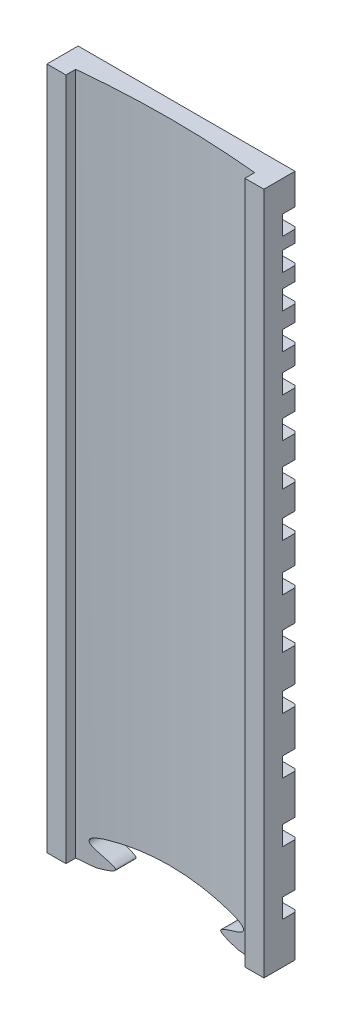
from build123d import *

# Parameters (mm, degrees)
SKETCH2_W               = 73.126
SKETCH2_H               = 465.703533893
BOSS_EXTRUDE1_DEPTH     = 12.8
CUT_EXTRUDE3_DEPTH      = 468.311966945
CUT_EXTRUDE3_DEPTH_BACK = 468.311966945
SKETCH4_W               = 73.126
SKETCH4_H               = 6.4
BOSS_EXTRUDE3_DEPTH     = 12.8
CHAMFER5_SIZE           = 0.7
SKETCH1_W               = 80.142296905
SKETCH1_H               = 6.5
CUT_EXTRUDE4_DEPTH      = 5
SKETCH7_W               = 73.126
SKETCH7_H               = 472.103533893
CUT_EXTRUDE7_DEPTH      = 1.6
CUT_EXTRUDE8_DEPTH      = 10
CUT_EXTRUDE8_DEPTH_BACK = 10
SKETCH6_OUTSIDE_W       = 170.698
SKETCH6_OUTSIDE_H       = 569.676


with BuildPart() as part:
    # Sketch2 → Boss-Extrude1 (new body)
    with BuildSketch(Plane.XY):
        with Locations((0, 232.851766947)):
            Rectangle(SKETCH2_W, SKETCH2_H)
    extrude(amount=BOSS_EXTRUDE1_DEPTH)

    # Sketch3 → Cut-Extrude3 (cut, two sides: drawn at the far end of the back side and taken through both)
    with BuildSketch(Plane(origin=(0, 0, 0), x_dir=(1, 0, 0), z_dir=(0, 1, 0)).offset(-CUT_EXTRUDE3_DEPTH_BACK)):
        with BuildLine():
            Line((30.163, -158.685232104), (30.163, -12.8))
            Line((30.163, -12.8), (30.163, -7.896136802))
            ThreePointArc((30.163, -7.896136802), (0, -6.4), (-30.163, -7.896136802))
            Line((-30.163, -7.896136802), (-30.163, -12.8))
            Line((-30.163, -12.8), (-30.163, -158.685232104))
            Line((-30.163, -158.685232104), (-30.163, -450.455696312))
            Line((-30.163, -450.455696312), (30.163, -450.455696312))
            Line((30.163, -450.455696312), (30.163, -158.685232104))
        make_face()
    extrude(amount=CUT_EXTRUDE3_DEPTH + CUT_EXTRUDE3_DEPTH_BACK, mode=Mode.SUBTRACT)

    # Sketch4 → Boss-Extrude3 (add)
    with BuildSketch(Plane.XY):
        with Locations((0, -3.2)):
            Rectangle(SKETCH4_W, SKETCH4_H)
    extrude(amount=BOSS_EXTRUDE3_DEPTH)

    # Chamfer5
    chamfer5_edges = [part.edges().sort_by_distance(p)[0] for p in [
        (0, -6.4, 0),
        (0, 465.703533893, 0),
        (36.563, 229.651766947, 0),
        (-36.563, 229.651766947, 0),
    ]]
    chamfer(chamfer5_edges, length=CHAMFER5_SIZE)

    # Sketch1 → Cut-Extrude4 (cut)
    with BuildSketch(Plane.XY):
        with Locations((0.607494054, 452.05915)):
            Rectangle(SKETCH1_W, SKETCH1_H)
        with Locations((0.607494054, 441.46337)):
            Rectangle(SKETCH1_W, SKETCH1_H)
        with Locations((0.607494054, 64.52931)):
            Rectangle(SKETCH1_W, SKETCH1_H)
        with Locations((0.607494054, 96.28078)):
            Rectangle(SKETCH1_W, SKETCH1_H)
        with Locations((0.607494054, 363.26539)):
            Rectangle(SKETCH1_W, SKETCH1_H)
        with Locations((0.607494054, 154.5375)):
            Rectangle(SKETCH1_W, SKETCH1_H)
        with Locations((0.607494054, 206.43835)):
            Rectangle(SKETCH1_W, SKETCH1_H)
        with Locations((0.607494054, 252.67674)):
            Rectangle(SKETCH1_W, SKETCH1_H)
        with Locations((0.607494054, 293.87047)):
            Rectangle(SKETCH1_W, SKETCH1_H)
        with Locations((0.607494054, 330.56991)):
            Rectangle(SKETCH1_W, SKETCH1_H)
        with Locations((0.607494054, 378.25008)):
            Rectangle(SKETCH1_W, SKETCH1_H)
        with Locations((0.607494054, 405.7436)):
            Rectangle(SKETCH1_W, SKETCH1_H)
        with Locations((0.607494054, 30.88981)):
            Rectangle(SKETCH1_W, SKETCH1_H)
        with Locations((0.607494054, 430.23753)):
            Rectangle(SKETCH1_W, SKETCH1_H)
        with Locations((0.607494054, 418.34417)):
            Rectangle(SKETCH1_W, SKETCH1_H)
        with Locations((0.607494054, 392.39375)):
            Rectangle(SKETCH1_W, SKETCH1_H)
        with Locations((0.607494054, 126.25017)):
            Rectangle(SKETCH1_W, SKETCH1_H)
        with Locations((0.607494054, 347.38966)):
            Rectangle(SKETCH1_W, SKETCH1_H)
        with Locations((0.607494054, 181.23719)):
            Rectangle(SKETCH1_W, SKETCH1_H)
        with Locations((0.607494054, 312.75)):
            Rectangle(SKETCH1_W, SKETCH1_H)
        with Locations((0.607494054, 230.22507)):
            Rectangle(SKETCH1_W, SKETCH1_H)
        with Locations((0.607494054, 273.8683)):
            Rectangle(SKETCH1_W, SKETCH1_H)
        with Locations((0.607494054, 4.75)):
            Rectangle(SKETCH1_W, SKETCH1_H)
    extrude(amount=CUT_EXTRUDE4_DEPTH, mode=Mode.SUBTRACT)

    # Sketch7 → Cut-Extrude7 (cut)
    with BuildSketch(Plane.XY.offset(12.8)):
        with Locations((0, 229.651766947)):
            Rectangle(SKETCH7_W, SKETCH7_H)
    extrude(amount=-CUT_EXTRUDE7_DEPTH, mode=Mode.SUBTRACT)

    # Sketch6 outside → Cut-Extrude8 (cut, two sides: drawn at the far end of the back side and taken through both)
    with BuildSketch(Plane.XY.offset(4).offset(-CUT_EXTRUDE8_DEPTH_BACK)):
        with Locations((0, 229.652)):
            Rectangle(SKETCH6_OUTSIDE_W, SKETCH6_OUTSIDE_H)
        with BuildLine():
            Line((38.819399417, 235.445141086), (23.928186757, 235.445141086))
            add(Edge.make_bspline(
                [(23.928186757, 235.445141086), (23.634849824, 235.507477299), (23.031189014, 235.639655742), (21.969312379, 235.88821652), (20.809440976, 236.190676279), (19.699206176, 236.534722785), (18.561458291, 236.968799885), (17.909438655, 237.36952197), (17.698622032, 237.670679376), (17.682919003, 237.797918725), (17.738978882, 237.958201954), (18.01477629, 238.258008409), (18.707086072, 238.670283753), (19.903022401, 239.161987643), (21.767157726, 239.816666548), (23.727896999, 240.480197876), (25.200068874, 241.208437761), (25.820280894, 241.711480358), (26.057271591, 242.246062804), (25.983508877, 242.852758289), (25.49786714, 243.345720269), (24.635703212, 243.834966697), (23.763882828, 244.210822116), (22.828254078, 244.537388924), (21.957380797, 244.804270038), (21.455661077, 244.946249908), (21.212148476, 245.012801136)],
                knots=[-5.4725e-05, -5.4725e-05, -5.4725e-05, -5.4725e-05, 0.015564317, 0.03118336, 0.062421446, 0.093659531, 0.124897617, 0.187373788, 0.218611873, 0.249849959, 0.281088044, 0.31232613, 0.374802301, 0.437278472, 0.499754643, 0.624706985, 0.687183156, 0.749659327, 0.780897413, 0.812135498, 0.874611669, 0.905849755, 0.93708784, 0.968325926, 0.983944969, 0.999564011, 0.999564011, 0.999564011, 0.999564011], degree=3))
            add(Edge.make_bspline(
                [(21.212148476, 245.012801136), (10.816043335, 247.609197459), (0, 247.617941223)],
                knots=[-9.418e-06, -9.418e-06, -9.418e-06, 1.000129115, 1.000129115, 1.000129115], degree=2))
            add(Edge.make_bspline(
                [(0, 247.617941223), (-10.816043335, 247.609197459), (-21.212148476, 245.012801136)],
                knots=[-9.418e-06, -9.418e-06, -9.418e-06, 1.000129115, 1.000129115, 1.000129115], degree=2))
            add(Edge.make_bspline(
                [(-21.212148476, 245.012801136), (-21.455661077, 244.946249908), (-21.957380797, 244.804270038), (-22.828254078, 244.537388924), (-23.763882828, 244.210822116), (-24.635703212, 243.834966697), (-25.49786714, 243.345720269), (-25.983508877, 242.852758289), (-26.057271591, 242.246062804), (-25.820280894, 241.711480358), (-25.200068874, 241.208437761), (-23.727896999, 240.480197876), (-21.767157726, 239.816666548), (-19.903022401, 239.161987643), (-18.707086072, 238.670283753), (-18.01477629, 238.258008409), (-17.738978882, 237.958201954), (-17.682919003, 237.797918725), (-17.698622032, 237.670679376), (-17.909438655, 237.36952197), (-18.561458291, 236.968799885), (-19.699206176, 236.534722785), (-20.809440976, 236.190676279), (-21.969312379, 235.88821652), (-23.031189014, 235.639655742), (-23.634849824, 235.507477299), (-23.928186757, 235.445141086)],
                knots=[-5.4725e-05, -5.4725e-05, -5.4725e-05, -5.4725e-05, 0.015564317, 0.03118336, 0.062421446, 0.093659531, 0.124897617, 0.187373788, 0.218611873, 0.249849959, 0.31232613, 0.374802301, 0.499754643, 0.562230814, 0.624706985, 0.687183156, 0.718421242, 0.749659327, 0.780897413, 0.812135498, 0.874611669, 0.905849755, 0.93708784, 0.968325926, 0.983944969, 0.999564011, 0.999564011, 0.999564011, 0.999564011], degree=3))
            Line((-23.928186757, 235.445141086), (-49.397443722, 235.445141086))
            Line((-49.397443722, 235.445141086), (-37.913552656, 471.811665653))
            Line((-37.913552656, 471.811665653), (38.819399417, 471.811665653))
            Line((38.819399417, 471.811665653), (38.819399417, 235.445141086))
        make_face(mode=Mode.SUBTRACT)
    extrude(amount=CUT_EXTRUDE8_DEPTH + CUT_EXTRUDE8_DEPTH_BACK, mode=Mode.SUBTRACT)


solid = part.part
